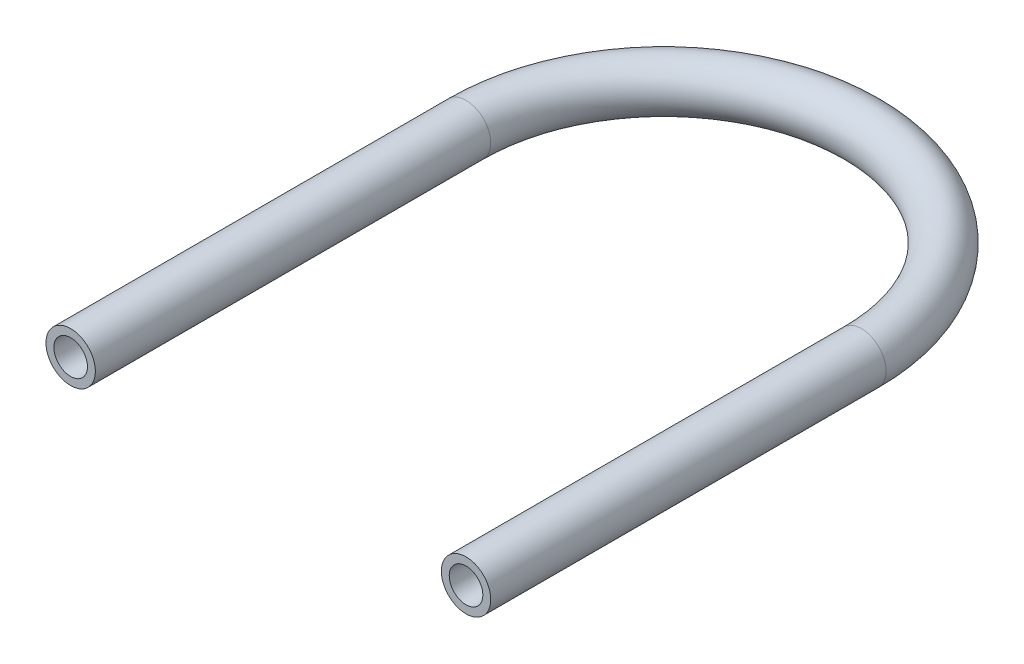
from build123d import *

# Parameters (mm, degrees)
SKETCH4_R   = 3.175
SKETCH4_R_2 = 2.159


with BuildPart() as part:
    # Sweep1: sweep along a path in Sketch3
    with BuildLine(Plane(origin=(0, 0, 0), x_dir=(1, 0, 0), z_dir=(0, 1, 0))) as sweep1_path:
        Line((-25.4, 0), (-25.4, 50.8))
        ThreePointArc((-25.4, 50.8), (0, 76.2), (25.4, 50.8))
        Line((25.4, 50.8), (25.4, 0))
    # Sketch4 → Sweep1 (sweep)
    with BuildSketch(Plane.XY):
        with Locations((-25.4, 0)):
            Circle(SKETCH4_R)
        with Locations((-25.4, 0)):
            Circle(SKETCH4_R_2, mode=Mode.SUBTRACT)
    sweep(path=sweep1_path.line)


solid = part.part
